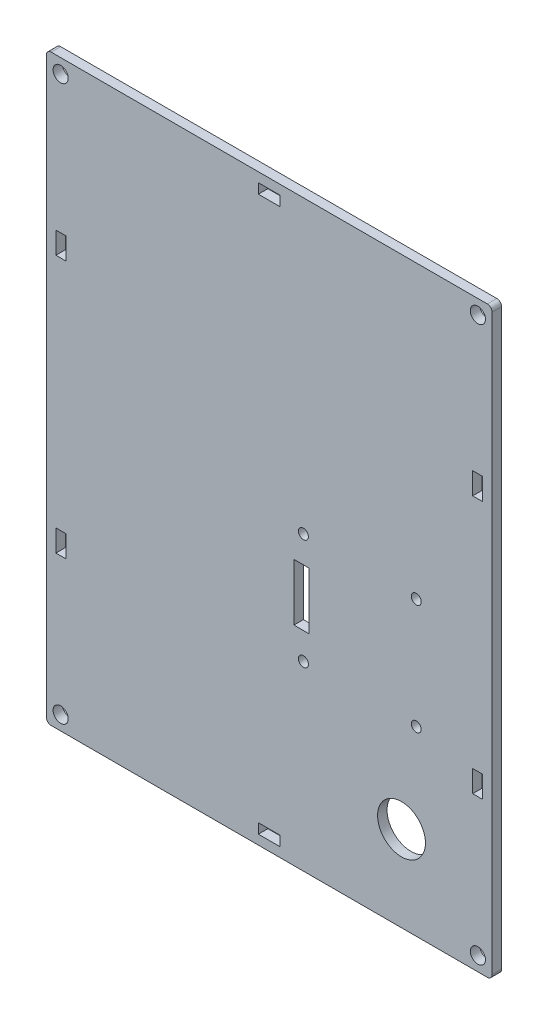
from build123d import *

# Parameters (mm, degrees)
SKETCH1_W           = 94
SKETCH1_H           = 123
SKETCH1_R           = 1.6
SKETCH1_W_2         = 4.6
SKETCH1_H_2         = 2.1
SKETCH1_W_3         = 2.1
SKETCH1_H_3         = 4.6
BOSS_EXTRUDE1_DEPTH = 1
FILLET1_R           = 1
CUT_EXTRUDE1_REACH  = 79.429
SKETCH2_R           = 5.05
SKETCH2_R_2         = 1.05
SKETCH2_W           = 3.2
SKETCH2_H           = 12


with BuildPart() as part:
    # Sketch1 → Boss-Extrude1 (new, symmetric)
    with BuildSketch(Plane.XY):
        Rectangle(SKETCH1_W, SKETCH1_H)
        with Locations((-44, 58.5)):
            Circle(SKETCH1_R, mode=Mode.SUBTRACT)
        with Locations(Location((-44, -58.5, 0), (0, 0, 180))):
            Circle(SKETCH1_R, mode=Mode.SUBTRACT)
        with Locations((44, -58.5)):
            Circle(SKETCH1_R, mode=Mode.SUBTRACT)
        with Locations(Location((44, 58.5, 0), (0, 0, 180))):
            Circle(SKETCH1_R, mode=Mode.SUBTRACT)
        with Locations((0, -58.45)):
            Rectangle(SKETCH1_W_2, SKETCH1_H_2, mode=Mode.SUBTRACT)
        with Locations((0, 58.45)):
            Rectangle(SKETCH1_W_2, SKETCH1_H_2, mode=Mode.SUBTRACT)
        with Locations((-43.95, -27.2)):
            Rectangle(SKETCH1_W_3, SKETCH1_H_3, mode=Mode.SUBTRACT)
        with Locations((-43.95, 27.2)):
            Rectangle(SKETCH1_W_3, SKETCH1_H_3, mode=Mode.SUBTRACT)
        with Locations((43.95, -27.2)):
            Rectangle(SKETCH1_W_3, SKETCH1_H_3, mode=Mode.SUBTRACT)
        with Locations((43.95, 27.2)):
            Rectangle(SKETCH1_W_3, SKETCH1_H_3, mode=Mode.SUBTRACT)
    extrude(amount=BOSS_EXTRUDE1_DEPTH, both=True)

    # Fillet1
    fillet1_edges = [part.edges().sort_by_distance(p)[0] for p in [
        (47, -61.5, 0),
        (-47, -61.5, 0),
        (-47, 61.5, 0),
        (47, 61.5, 0),
    ]]
    fillet(fillet1_edges, radius=FILLET1_R)

    # Sketch2 → Cut-Extrude1 (cut, up to next)
    with BuildSketch(Plane.XY.offset(1), mode=Mode.PRIVATE) as cut_extrude1_sk1:
        with Locations((27.890121282, -43.5)):
            Circle(SKETCH2_R)
    cut_extrude1_tool1 = extrude(cut_extrude1_sk1.sketch, amount=-CUT_EXTRUDE1_REACH, mode=Mode.PRIVATE) & part.part
    # Sketch2 → Cut-Extrude1 (cut, up to next)
    with BuildSketch(Plane.XY.offset(1), mode=Mode.PRIVATE) as cut_extrude1_sk2:
        with Locations((7.2, -23.2)):
            Circle(SKETCH2_R_2)
    cut_extrude1_tool2 = extrude(cut_extrude1_sk2.sketch, amount=-CUT_EXTRUDE1_REACH, mode=Mode.PRIVATE) & part.part
    # Sketch2 → Cut-Extrude1 (cut, up to next)
    with BuildSketch(Plane.XY.offset(1), mode=Mode.PRIVATE) as cut_extrude1_sk3:
        with Locations((31, -23.2)):
            Circle(SKETCH2_R_2)
    cut_extrude1_tool3 = extrude(cut_extrude1_sk3.sketch, amount=-CUT_EXTRUDE1_REACH, mode=Mode.PRIVATE) & part.part
    # Sketch2 → Cut-Extrude1 (cut, up to next)
    with BuildSketch(Plane.XY.offset(1), mode=Mode.PRIVATE) as cut_extrude1_sk4:
        with Locations((31, 0.1)):
            Circle(SKETCH2_R_2)
    cut_extrude1_tool4 = extrude(cut_extrude1_sk4.sketch, amount=-CUT_EXTRUDE1_REACH, mode=Mode.PRIVATE) & part.part
    # Sketch2 → Cut-Extrude1 (cut, up to next)
    with BuildSketch(Plane.XY.offset(1), mode=Mode.PRIVATE) as cut_extrude1_sk5:
        with Locations((7.2, 0.1)):
            Circle(SKETCH2_R_2)
    cut_extrude1_tool5 = extrude(cut_extrude1_sk5.sketch, amount=-CUT_EXTRUDE1_REACH, mode=Mode.PRIVATE) & part.part
    # Sketch2 → Cut-Extrude1 (cut, up to next)
    with BuildSketch(Plane.XY.offset(1), mode=Mode.PRIVATE) as cut_extrude1_sk6:
        with Locations((6.8, -11.55)):
            Rectangle(SKETCH2_W, SKETCH2_H)
    cut_extrude1_tool6 = extrude(cut_extrude1_sk6.sketch, amount=-CUT_EXTRUDE1_REACH, mode=Mode.PRIVATE) & part.part
    add(cut_extrude1_tool1.solids().sort_by_distance((27.890121, -43.5, 1))[0], mode=Mode.SUBTRACT)
    add(cut_extrude1_tool2.solids().sort_by_distance((7.2, -23.2, 1))[0], mode=Mode.SUBTRACT)
    add(cut_extrude1_tool3.solids().sort_by_distance((31, -23.2, 1))[0], mode=Mode.SUBTRACT)
    add(cut_extrude1_tool4.solids().sort_by_distance((31, 0.1, 1))[0], mode=Mode.SUBTRACT)
    add(cut_extrude1_tool5.solids().sort_by_distance((7.2, 0.1, 1))[0], mode=Mode.SUBTRACT)
    add(cut_extrude1_tool6.solids().sort_by_distance((6.8, -11.55, 1))[0], mode=Mode.SUBTRACT)


solid = part.part
